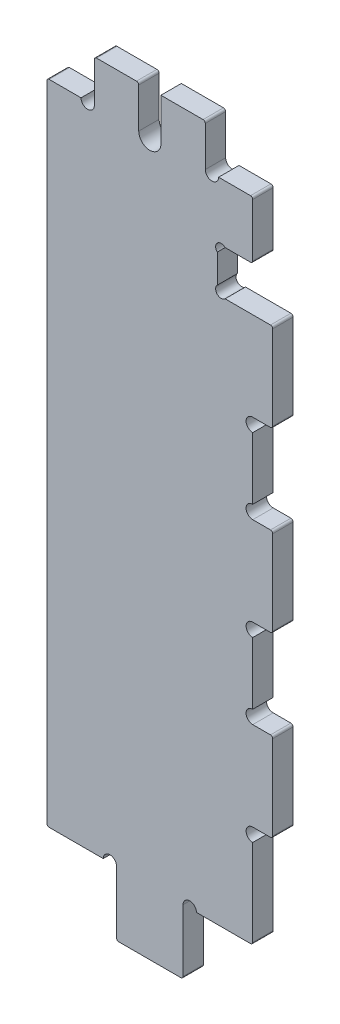
from build123d import *

# Parameters (mm, degrees)
BOSS_EXTRUDE1_DEPTH = 4.6
CUT_EXTRUDE1_DEPTH  = 164.683291756
SKETCH8_W           = 8
SKETCH8_H           = 10
CUT_EXTRUDE4_DEPTH  = 10
SKETCH9_R           = 1.25
CUT_EXTRUDE5_DEPTH  = 10
FILLET1_R           = 0.5


with BuildPart() as part:
    # Sketch1 → Boss-Extrude1 (new body)
    with BuildSketch(Plane.XY):
        Polygon((10.7, 146), (10.7, 155.5), (20.7, 155.5), (20.7, 146), (25.7, 146), (25.7, 155.5), (35.7, 155.5), (35.7, 146), (46.4, 146), (46.4, 123), (50.9, 123), (50.9, 103), (46.4, 103), (46.4, 83), (50.9, 83), (50.9, 63), (46.4, 63), (46.4, 43), (50.9, 43), (50.9, 23), (46.4, 23), (46.4, 0), (30.7, 0), (30.7, -14.5), (15.7, -14.5), (15.7, 0), (0, 0), (0, 146), align=None)
    extrude(amount=BOSS_EXTRUDE1_DEPTH)

    # Sketch2 → Cut-Extrude1 (cut, through all)
    with BuildSketch(Plane.XY.offset(4.6)):
        with BuildLine():
            Line((15.7, 0), (15.7, -5))
            ThreePointArc((15.7, -5), (14.2, -6.5), (12.7, -5))
            Line((12.7, -5), (12.7, 0))
            ThreePointArc((12.7, 0), (14.2, 1.5), (15.7, 0))
        make_face()
        with BuildLine():
            Line((30.7, 0), (30.7, -5))
            ThreePointArc((30.7, -5), (32.2, -6.5), (33.7, -5))
            Line((33.7, -5), (33.7, 0))
            ThreePointArc((33.7, 0), (32.2, 1.5), (30.7, 0))
        make_face()
        with BuildLine():
            Line((46.4, 23), (50.9, 23))
            ThreePointArc((50.9, 23), (52.4, 21.5), (50.9, 20))
            Line((50.9, 20), (46.4, 20))
            ThreePointArc((46.4, 20), (44.9, 21.5), (46.4, 23))
        make_face()
        with BuildLine():
            Line((46.4, 63), (50.9, 63))
            ThreePointArc((50.9, 63), (52.4, 61.5), (50.9, 60))
            Line((50.9, 60), (46.4, 60))
            ThreePointArc((46.4, 60), (44.9, 61.5), (46.4, 63))
        make_face()
        with BuildLine():
            Line((46.4, 103), (50.9, 103))
            ThreePointArc((50.9, 103), (52.4, 101.5), (50.9, 100))
            Line((50.9, 100), (46.4, 100))
            ThreePointArc((46.4, 100), (44.9, 101.5), (46.4, 103))
        make_face()
        with BuildLine():
            Line((46.4, 43), (50.9, 43))
            ThreePointArc((50.9, 43), (52.4, 44.5), (50.9, 46))
            Line((50.9, 46), (46.4, 46))
            ThreePointArc((46.4, 46), (44.9, 44.5), (46.4, 43))
        make_face()
        with BuildLine():
            Line((46.4, 83), (50.9, 83))
            ThreePointArc((50.9, 83), (52.4, 84.5), (50.9, 86))
            Line((50.9, 86), (46.4, 86))
            ThreePointArc((46.4, 86), (44.9, 84.5), (46.4, 83))
        make_face()
        with BuildLine():
            Line((35.7, 146), (35.7, 155.5))
            ThreePointArc((35.7, 155.5), (37.2, 157), (38.7, 155.5))
            Line((38.7, 155.5), (38.7, 146))
            ThreePointArc((38.7, 146), (37.2, 144.5), (35.7, 146))
        make_face()
        with BuildLine():
            Line((25.7, 146), (25.7, 155.5))
            ThreePointArc((25.7, 155.5), (23.2, 158), (20.7, 155.5))
            Line((20.7, 155.5), (20.7, 146))
            ThreePointArc((20.7, 146), (23.2, 143.5), (25.7, 146))
        make_face()
        with BuildLine():
            Line((10.7, 146), (10.7, 155.5))
            ThreePointArc((10.7, 155.5), (9.2, 157), (7.7, 155.5))
            Line((7.7, 155.5), (7.7, 146))
            ThreePointArc((7.7, 146), (9.2, 144.5), (10.7, 146))
        make_face()
    extrude(amount=-CUT_EXTRUDE1_DEPTH, mode=Mode.SUBTRACT)

    # Sketch8 → Cut-Extrude4 (cut)
    with BuildSketch(Plane(origin=(0, 0, 0), x_dir=(-1, 0, 0), z_dir=(0, 0, -1))):
        with Locations((-42.4, 128)):
            Rectangle(SKETCH8_W, SKETCH8_H)
    extrude(amount=-CUT_EXTRUDE4_DEPTH, mode=Mode.SUBTRACT)

    # Sketch9 → Cut-Extrude5 (cut)
    with BuildSketch(Plane(origin=(0, 0, 0), x_dir=(-1, 0, 0), z_dir=(0, 0, -1))):
        with Locations((-39.28, 132.112250035)):
            Circle(SKETCH9_R)
        with Locations((-39.28, 123.887749965)):
            Circle(SKETCH9_R)
    extrude(amount=-CUT_EXTRUDE5_DEPTH, mode=Mode.SUBTRACT)

    # Fillet1
    fillet1_edges = [part.edges().sort_by_distance(p)[0] for p in [
        (46.4, 133, 2.3),
        (0, 146, 2.3),
        (10.7, 155.5, 2.3),
        (20.7, 155.5, 2.3),
        (35.7, 155.5, 2.3),
        (46.4, 146, 2.3),
        (50.9, 123, 2.3),
        (50.9, 103, 2.3),
        (50.9, 83, 2.3),
        (50.9, 63, 2.3),
        (50.9, 43, 2.3),
        (50.9, 23, 2.3),
        (46.4, 0, 2.3),
        (30.7, -14.5, 2.3),
        (15.7, -14.5, 2.3),
        (0, 0, 2.3),
    ]]
    fillet(fillet1_edges, radius=FILLET1_R)


solid = part.part
